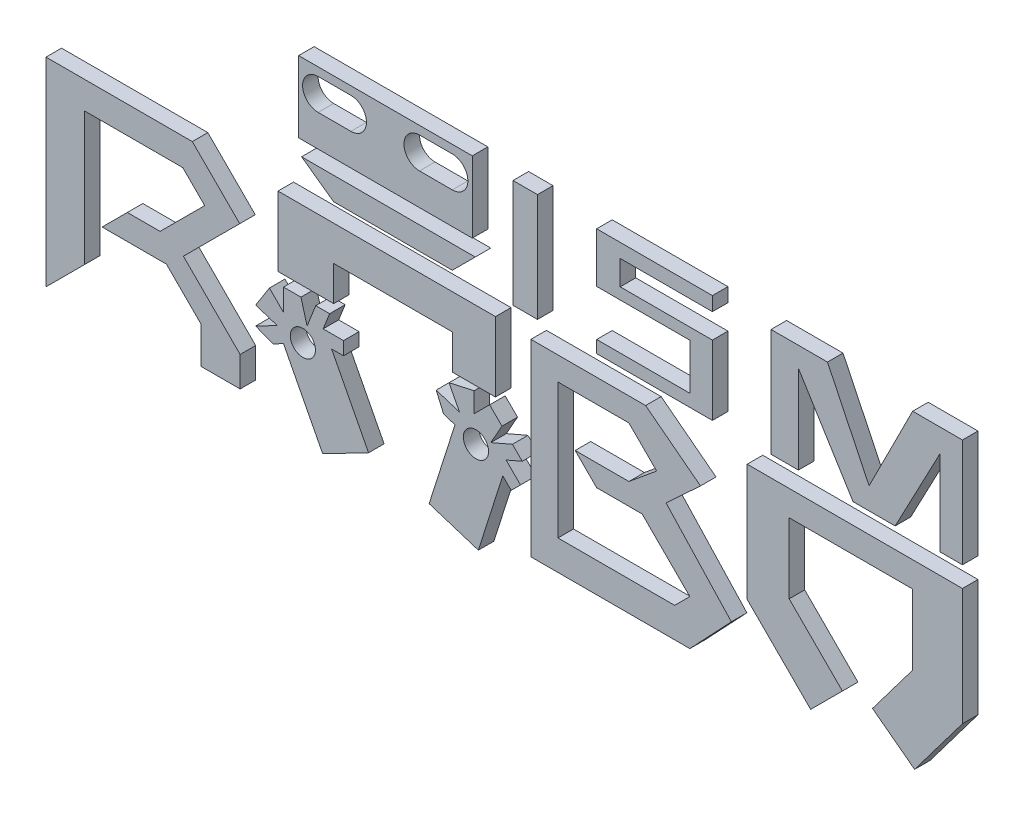
from build123d import *

# Parameters (mm, degrees)
BOSS_EXTRUDE2_DEPTH    = 5.08
SKETCH1_R              = 4.12365759
BOSS_EXTRUDE2_2_DEPTH  = 5.08
BOSS_EXTRUDE2_3_DEPTH  = 5.08
BOSS_EXTRUDE2_4_DEPTH  = 5.08
BOSS_EXTRUDE2_5_DEPTH  = 5.08
BOSS_EXTRUDE2_6_DEPTH  = 5.08
BOSS_EXTRUDE2_7_DEPTH  = 5.08
BOSS_EXTRUDE2_8_DEPTH  = 5.08
BOSS_EXTRUDE2_9_DEPTH  = 5.08
SKETCH1_W              = 56.784840995
SKETCH1_H              = 23.30321305
BOSS_EXTRUDE2_10_DEPTH = 5.08
SKETCH1_W_2            = 7.98939124
SKETCH1_H_2            = 35.356599111
BOSS_EXTRUDE2_11_DEPTH = 5.08


with BuildPart() as part:
    # Sketch1 → Boss-Extrude2 (new body)
    with BuildSketch(Plane.XY):
        Polygon((-54.90986983, 2.100106655), (-40.789904432, 2.100106655), (-40.789904432, 24.879849932), (-45.332766375, 24.879849932), (-48.688287769, 24.879849932), (-105.473128764, 24.879849932), (-111.90160133, 24.879849932), (-111.90160133, 2.100106655), (-93.694987642, 2.100106655), (-93.694987642, 13.489978293), (-54.90986983, 13.489978293), align=None)
    extrude(amount=BOSS_EXTRUDE2_DEPTH)


with BuildPart() as body_2:
    # Sketch1 → Boss-Extrude2 2 (new body)
    with BuildSketch(Plane.XY):
        Polygon((-82.285889521, -34.441030144), (-84.890843391, -35.788420077), (-97.289742004, -42.201643497), (-110.097906272, -17.439192577), (-113.56798426, -19.234060502), (-119.217545048, -16.998965022), (-112.12746233, -13.331680858), (-119.217545048, -11.075745447), (-114.705674228, -3.985662729), (-110.097906272, -8.593430684), (-110.097906272, -1.407450831), (-104.392826637, -1.407450831), (-102.397131845, -8.593430684), (-99.554193838, -1.407450831), (-95.015933067, -1.407450831), (-97.133073497, -6.758861392), (-90.477672296, -6.758861392), (-90.477672296, -11.075745447), (-94.371381606, -11.075745447), align=None)
        with Locations((-103.77421688, -14.054851273)):
            Circle(SKETCH1_R, mode=Mode.SUBTRACT)
    extrude(amount=BOSS_EXTRUDE2_2_DEPTH)


with BuildPart() as body_3:
    # Sketch1 → Boss-Extrude2 3 (new body)
    with BuildSketch(Plane.XY):
        Polygon((-35.236909604, -8.501269043), (-32.027874638, -11.710304009), (-37.308937689, -13.997278351), (-32.602858369, -18.703357672), (-35.655356358, -21.755855661), (-38.408624614, -19.002587404), (-46.384642461, -44.070072065), (-48.851145887, -43.28527552), (-62.481550623, -38.948328558), (-54.028593468, -12.381891785), (-57.751472426, -11.19733939), (-60.165863999, -5.622045475), (-52.559256928, -8.042329543), (-55.977515271, -1.433696747), (-47.773695248, 0.389374369), (-47.773695248, -6.126993566), (-42.692440165, -1.045738482), (-38.658339667, -5.07983898), (-42.32842543, -11.572263384), align=None)
        with Locations((-47.163979131, -14.460324751)):
            Circle(SKETCH1_R, mode=Mode.SUBTRACT)
    extrude(amount=BOSS_EXTRUDE2_3_DEPTH)


with BuildPart() as body_4:
    # Sketch1 → Boss-Extrude2 4 (new body)
    with BuildSketch(Plane.XY):
        Polygon((81.385387958, 38.064340239), (95.623529412, 66.293623332), (104.606250712, 66.293623332), (111.915994426, 66.293623332), (111.915994426, 30.937024221), (104.606250712, 30.937024221), (104.606250712, 58.793738672), (89.90577083, 30.937024221), (76.137891998, 30.937024221), (58.26778152, 59.783295915), (58.26778152, 30.937024221), (49.319663331, 30.937024221), (49.319663331, 66.293623332), (67.772807532, 66.293623332), align=None)
    extrude(amount=BOSS_EXTRUDE2_4_DEPTH)


with BuildPart() as body_5:
    # Sketch1 → Boss-Extrude2 5 (new body)
    with BuildSketch(Plane.XY):
        Polygon((0, 61.740121931), (0, 53.704531224), (30.145124355, 53.704531224), (30.145124355, 30.937024221), (-7.700774427, 30.937024221), (-7.700774427, 34.948768743), (22.767507003, 34.948768743), (22.767507003, 49.968824274), (-7.700774427, 49.968824274), (-7.700774427, 66.293623332), (30.145124355, 66.293623332), (30.145124355, 61.740121931), align=None)
    extrude(amount=BOSS_EXTRUDE2_5_DEPTH)


with BuildPart() as body_6:
    # Sketch1 → Boss-Extrude2 6 (new body)
    with BuildSketch(Plane.XY):
        Polygon((-47.409985171, 38.436908881), (-104.194826166, 38.436908881), (-93.694987642, 30.937024221), (-54.90986983, 30.937024221), align=None)
    extrude(amount=BOSS_EXTRUDE2_6_DEPTH)


with BuildPart() as body_7:
    # Sketch1 → Boss-Extrude2 7 (new body)
    with BuildSketch(Plane.XY):
        Polygon((-124.283802933, -37.365496787), (-137.140748064, -37.365496787), (-137.140748064, -25.312110727), (-148.390575054, -14.062283737), (-169.417037403, -14.062283737), (-161.180556929, -5.825803262), (-150.466435986, -5.825803262), (-135.868446202, 8.772186522), (-143.033514582, 15.937254902), (-175.17587741, 15.937254902), (-175.17587741, -27.588861427), (-187.764969517, -40.177953534), (-187.764969517, 24.879849932), (-139.922723552, 24.879849932), (-124.417729445, 9.374855825), (-142.832624815, -9.040039545), (-124.283802933, -27.588861427), align=None)
    extrude(amount=BOSS_EXTRUDE2_7_DEPTH)


with BuildPart() as body_8:
    # Sketch1 → Boss-Extrude2 8 (new body)
    with BuildSketch(Plane.XY):
        Polygon((111.915994426, -14.062283737), (111.915994426, 24.240698632), (41.517218652, 24.240698632), (41.517218652, -14.062283737), (62.275827978, -34.820893063), (72.655132641, -24.4415884), (55.24468611, -7.031141869), (55.24468611, 15.937254902), (95.623529412, 15.937254902), (95.623529412, -7.031141869), (82.498731257, -24.4415884), (96.267196627, -34.820893063), align=None)
    extrude(amount=BOSS_EXTRUDE2_8_DEPTH)


with BuildPart() as body_9:
    # Sketch1 → Boss-Extrude2 9 (new body)
    with BuildSketch(Plane.XY):
        Polygon((-29.195979568, -37.365496787), (22.767507003, -37.365496787), (36.34068378, -22.982523266), (14.999769319, 0), (26.249596309, 10.446267919), (8.30344373, 24.240698632), (-29.195979568, 24.240698632), align=None)
        Polygon((2.842938007, 16.576406201), (11.919459549, 7.49988466), (2.842938007, 0), (-14.731916296, 0), (-7.700774427, -7.031141869), (7.16506838, -7.031141869), (22.767507003, -22.633580491), (17.812226067, -27.588861427), (-20.356829791, -27.588861427), (-20.356829791, 16.576406201), align=None, mode=Mode.SUBTRACT)
    extrude(amount=BOSS_EXTRUDE2_9_DEPTH)


with BuildPart() as body_10:
    # Sketch1 → Boss-Extrude2 10 (new body)
    with BuildSketch(Plane.XY):
        with Locations((-76.767269056, 54.963637936)):
            Rectangle(SKETCH1_W, SKETCH1_H)
        with BuildLine():
            ThreePointArc((-88.067611926, 53.704531224), (-82.978404478, 58.793738672), (-88.067611926, 63.88294612))
            Line((-88.067611926, 63.88294612), (-98.781732868, 63.88294612))
            ThreePointArc((-98.781732868, 63.88294612), (-103.870940316, 58.793738672), (-98.781732868, 53.704531224))
            Line((-98.781732868, 53.704531224), (-88.067611926, 53.704531224))
        make_face(mode=Mode.SUBTRACT)
        with BuildLine():
            ThreePointArc((-54.90986983, 53.704531224), (-49.820662383, 58.793738672), (-54.90986983, 63.88294612))
            Line((-54.90986983, 63.88294612), (-65.623990773, 63.88294612))
            ThreePointArc((-65.623990773, 63.88294612), (-70.71319822, 58.793738672), (-65.623990773, 53.704531224))
            Line((-65.623990773, 53.704531224), (-54.90986983, 53.704531224))
        make_face(mode=Mode.SUBTRACT)
    extrude(amount=BOSS_EXTRUDE2_10_DEPTH)


with BuildPart() as body_11:
    # Sketch1 → Boss-Extrude2 11 (new body)
    with BuildSketch(Plane.XY):
        with Locations((-31.053612545, 48.615323777)):
            Rectangle(SKETCH1_W_2, SKETCH1_H_2)
    extrude(amount=BOSS_EXTRUDE2_11_DEPTH)


solid = Compound([part.part, body_2.part, body_3.part, body_4.part, body_5.part, body_6.part, body_7.part, body_8.part, body_9.part, body_10.part, body_11.part])
